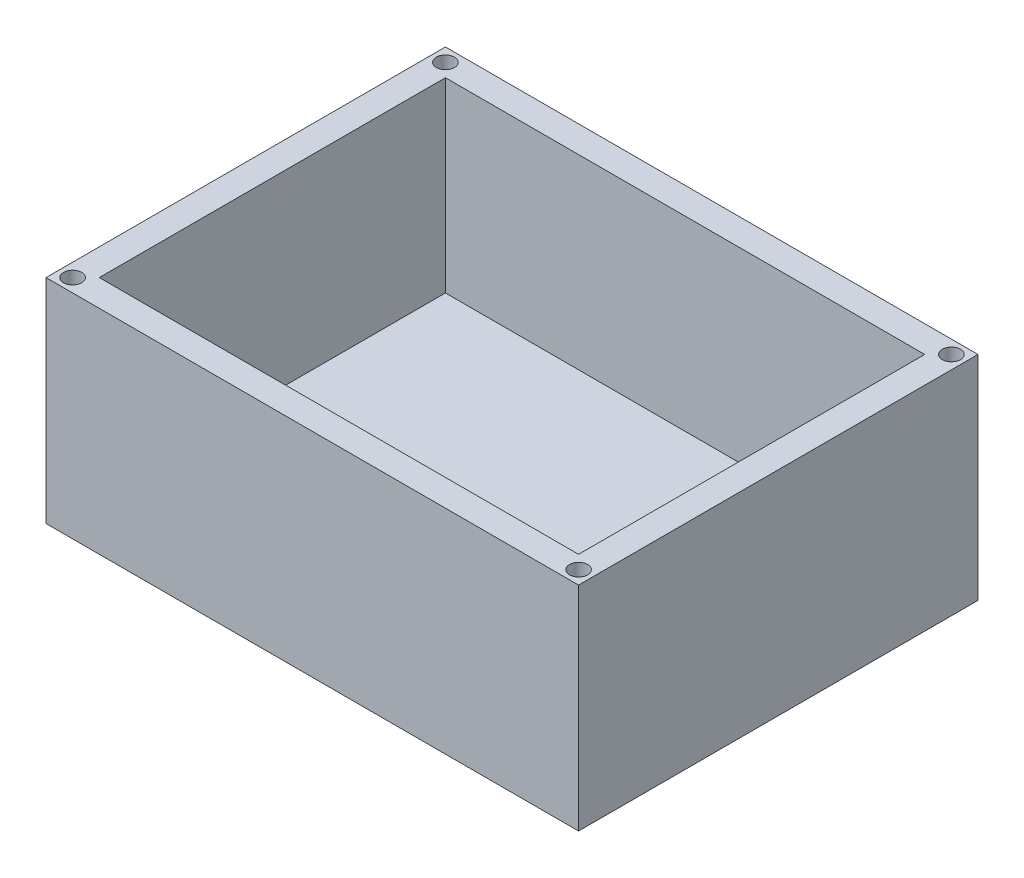
from build123d import *

# Parameters (mm, degrees)
CROQUIS1_W                       = 100
CROQUIS1_H                       = 75
SALIENTE_EXTRUIR1_DEPTH          = 40
CROQUIS2_W                       = 90
CROQUIS2_H                       = 65
CORTAR_EXTRUIR1_DEPTH            = 105.472453923
CROQUIS3_W                       = 90
CROQUIS3_H                       = 65
SALIENTE_EXTRUIR2_DEPTH          = 5
TALADRO_DE_MARGEN_PARA_M31_D     = 3.4
TALADRO_DE_MARGEN_PARA_M31_DEPTH = 20
TALADRO_DE_MARGEN_PARA_M31_TIP   = 1.021463052


with BuildPart() as part:
    # Croquis1 → Saliente-Extruir1 (new body)
    with BuildSketch(Plane(origin=(0, 0, 0), x_dir=(1, 0, 0), z_dir=(0, 1, 0))):
        with Locations((25.018270402, -23.21863581)):
            Rectangle(CROQUIS1_W, CROQUIS1_H)
    extrude(amount=SALIENTE_EXTRUIR1_DEPTH)

    # Croquis2 → Cortar-Extruir1 (cut, through all)
    with BuildSketch(Plane(origin=(0, 0, 0), x_dir=(1, 0, 0), z_dir=(0, 1, 0))):
        with Locations((25.018270402, -23.21863581)):
            Rectangle(CROQUIS2_W, CROQUIS2_H)
    extrude(amount=CORTAR_EXTRUIR1_DEPTH, mode=Mode.SUBTRACT)

    # Croquis3 → Saliente-Extruir2 (add)
    with BuildSketch(Plane(origin=(0, 0, 0), x_dir=(1, 0, 0), z_dir=(0, 1, 0))):
        with Locations((25.018270402, -23.21863581)):
            Rectangle(CROQUIS3_W, CROQUIS3_H)
    extrude(amount=SALIENTE_EXTRUIR2_DEPTH)

    # Taladro de margen para M31
    with Locations(Plane(origin=(-22.481719301, 40, -11.781363893), x_dir=(0, 0, 1), z_dir=(0, 1, 0))):
        with Locations((0, 0), (-2.33e-07, 94.999989703), (69.999999703, 94.999989703), (69.999999703, 1.038e-06)):
            Hole(TALADRO_DE_MARGEN_PARA_M31_D / 2, depth=TALADRO_DE_MARGEN_PARA_M31_DEPTH)
            with Locations((0, 0, -(TALADRO_DE_MARGEN_PARA_M31_DEPTH + TALADRO_DE_MARGEN_PARA_M31_TIP / 2))):  # 118° drill point
                Cone(0, TALADRO_DE_MARGEN_PARA_M31_D / 2, TALADRO_DE_MARGEN_PARA_M31_TIP, mode=Mode.SUBTRACT)


solid = part.part
